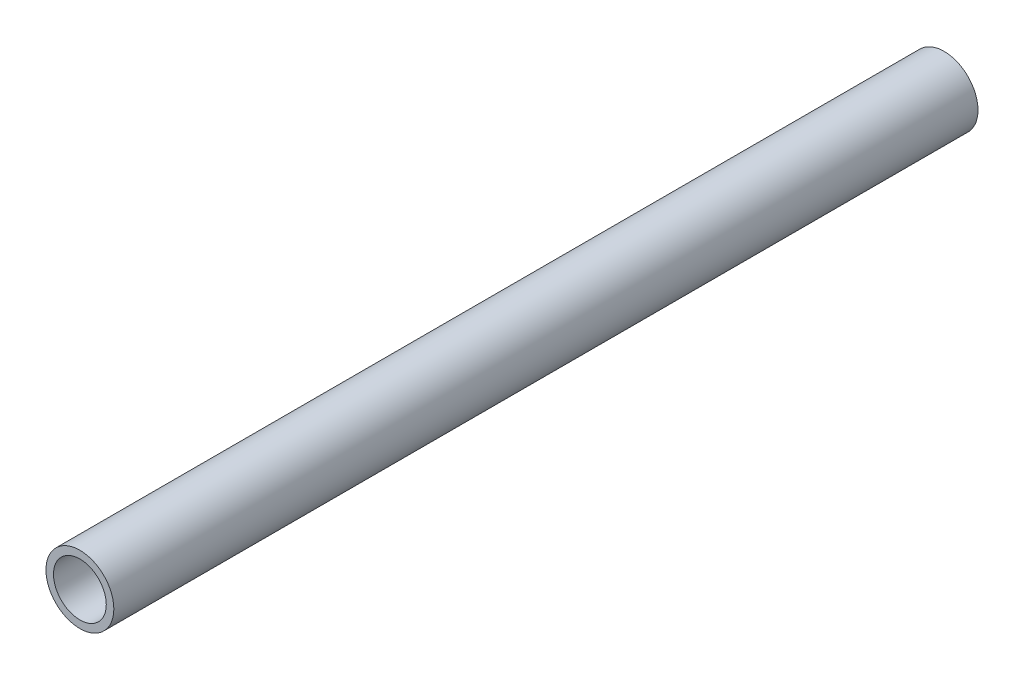
from build123d import *

# Parameters (mm, degrees)
SKETCH1_R           = 9
SKETCH1_R_2         = 7
BOSS_EXTRUDE1_DEPTH = 229.14


with BuildPart() as part:
    # Sketch1 → Boss-Extrude1 (new body)
    with BuildSketch(Plane.XY):
        Circle(SKETCH1_R)
        Circle(SKETCH1_R_2, mode=Mode.SUBTRACT)
    extrude(amount=BOSS_EXTRUDE1_DEPTH)


solid = part.part
